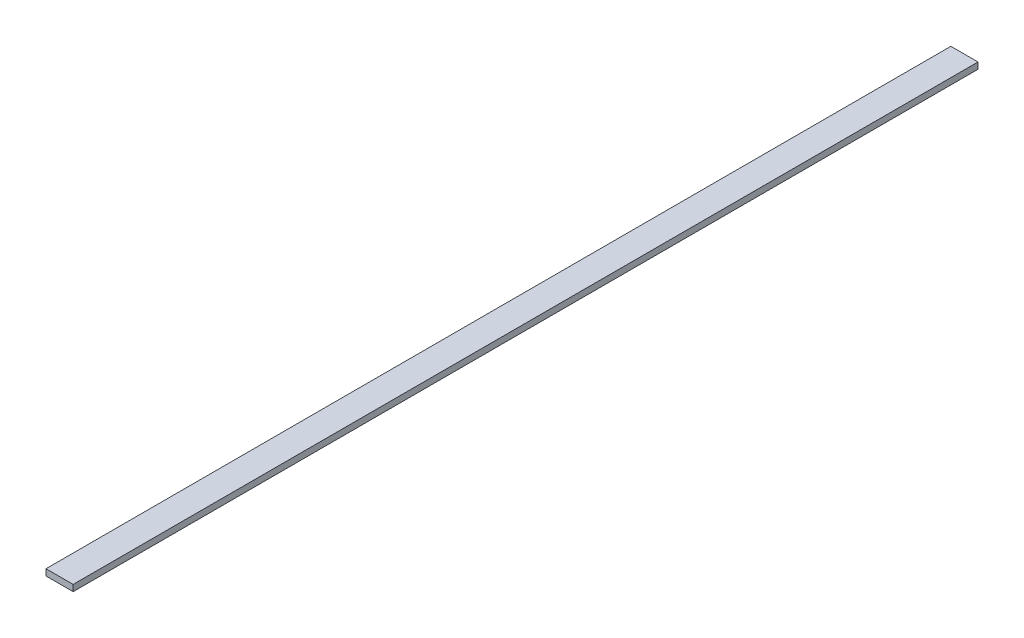
from build123d import *

# Parameters (mm, degrees)
SKETCH1_W           = 2.999994
SKETCH1_H           = 0.700024
BOSS_EXTRUDE1_DEPTH = 100


with BuildPart() as part:
    # Sketch1 → Boss-Extrude1 (new body)
    with BuildSketch(Plane.XY):
        with Locations((0.69906864, 0.119823928)):
            Rectangle(SKETCH1_W, SKETCH1_H)
    extrude(amount=BOSS_EXTRUDE1_DEPTH)


solid = part.part
